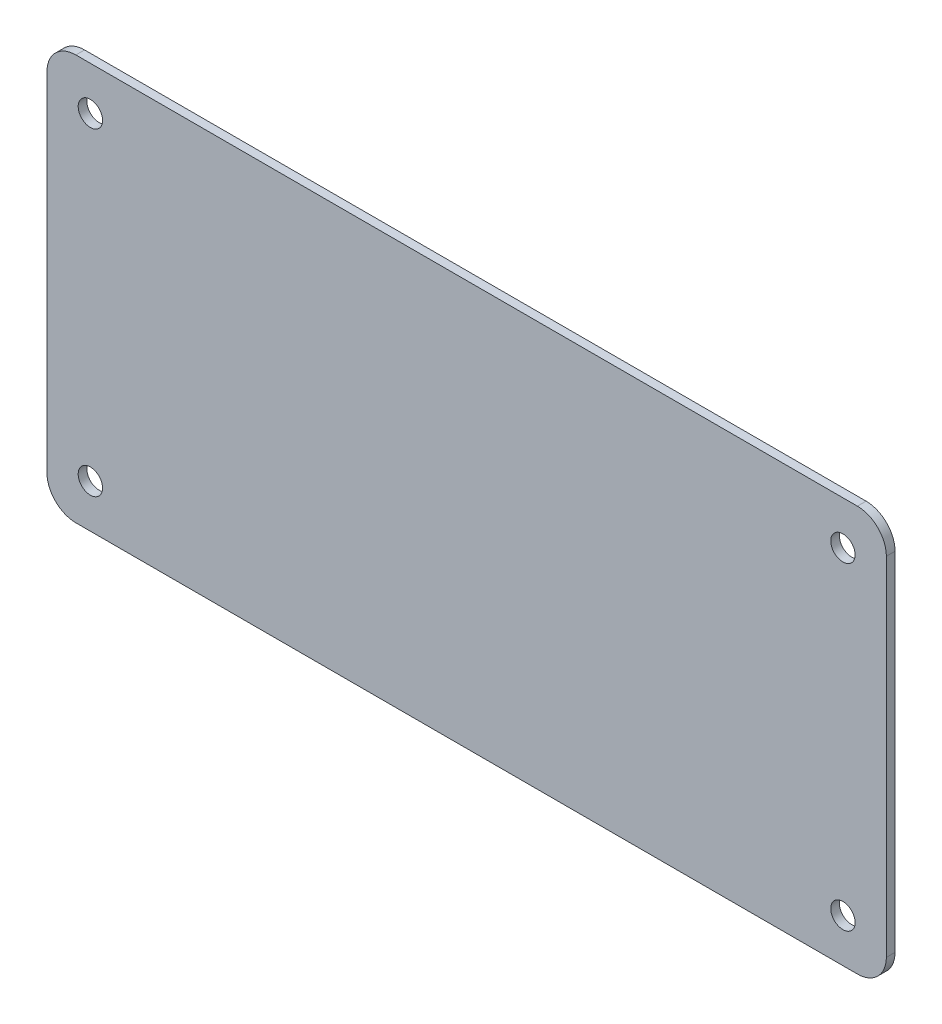
from build123d import *

# Parameters (mm, degrees)
SKETCH_1_W          = 290
SKETCH_1_H          = 140
EXTRUDE_1_DEPTH     = 3
FILLET_1_R          = 10
SKETCH_2_R          = 4.213642015
CUT_EXTRUDE_1_DEPTH = 3


with BuildPart() as part:
    # 草图1 → 凸台-拉伸1 (new body)
    with BuildSketch(Plane.XY):
        Rectangle(SKETCH_1_W, SKETCH_1_H)
    extrude(amount=EXTRUDE_1_DEPTH)

    # 圆角1
    fillet_1_edges = [part.edges().sort_by_distance(p)[0] for p in [
        (145, -70, 1.5),
        (-145, -70, 1.5),
        (-145, 70, 1.5),
        (145, 70, 1.5),
    ]]
    fillet(fillet_1_edges, radius=FILLET_1_R)

    # 草图2 → 切除-拉伸1 (cut)
    with BuildSketch(Plane.XY.offset(3)):
        with Locations((-130, 55)):
            Circle(SKETCH_2_R)
        with Locations((-130, -55)):
            Circle(SKETCH_2_R)
        with Locations((130, 55)):
            Circle(SKETCH_2_R)
        with Locations((130, -55)):
            Circle(SKETCH_2_R)
    extrude(amount=-CUT_EXTRUDE_1_DEPTH, mode=Mode.SUBTRACT)


solid = part.part
